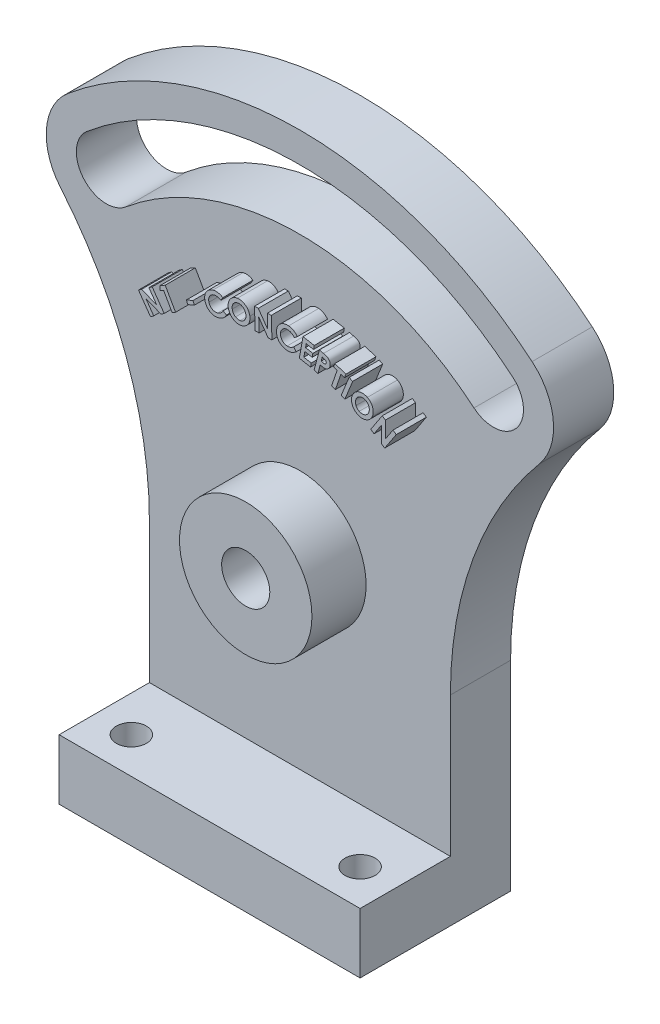
from build123d import *

# Parameters (mm, degrees)
SKETCH1_W             = 50
SKETCH1_H             = 10
BOSS_EXTRUDE2_DEPTH   = 25
SKETCH1_6_R           = 11
BOSS_EXTRUDE4_DEPTH   = 10
SKETCH1_7_R           = 11
SKETCH1_7_R_2         = 4
BOSS_EXTRUDE5_DEPTH   = 19
F_5_0MM_DOWEL_HOLE1_D = 5
BOSS_EXTRUDE8_DEPTH   = 15


with BuildPart() as part:
    # Sketch1 → Boss-Extrude2 (new body)
    with BuildSketch(Plane.XY):
        with Locations((0, 5)):
            Rectangle(SKETCH1_W, SKETCH1_H)
    extrude(amount=BOSS_EXTRUDE2_DEPTH)

    # Sketch1<6> → Boss-Extrude4 (add)
    # profile 1 of 2: a face of its own
    with BuildSketch(Plane.XY):
        with BuildLine():
            Line((-25, 33.212161292), (-25, 10))
            Line((-25, 10), (25, 10))
            Line((25, 10), (25, 33.212161292))
            ThreePointArc((25, 33.212161292), (28.814992323, 54.848057897), (39.799824916, 73.874346059))
            ThreePointArc((39.799824916, 73.874346059), (33.010937912, 70.340275175), (25.711504387, 72.641777725))
            ThreePointArc((25.711504387, 72.641777725), (0, 82), (-25.711504387, 72.641777725))
            ThreePointArc((-25.711504387, 72.641777725), (-33.010937912, 70.340275175), (-39.799824916, 73.874346059))
            ThreePointArc((-39.799824916, 73.874346059), (-28.814992323, 54.848057897), (-25, 33.212161292))
        make_face()
        with Locations((0, 42)):
            Circle(SKETCH1_6_R, mode=Mode.SUBTRACT)
    # profile 2 of 2: a face of its own
    with BuildSketch(Plane.XY):
        with BuildLine():
            ThreePointArc((38.567256581, 87.962666587), (0, 102), (-38.567256581, 87.962666587))
            ThreePointArc((-38.567256581, 87.962666587), (-39.799824916, 73.874346059), (-25.711504387, 72.641777725))
            ThreePointArc((-25.711504387, 72.641777725), (0, 82), (25.711504387, 72.641777725))
            ThreePointArc((25.711504387, 72.641777725), (39.799824916, 73.874346059), (38.567256581, 87.962666587))
        make_face()
        with BuildLine():
            ThreePointArc((-35.353318533, 84.132444372), (-35.9696027, 77.088284108), (-28.925442436, 76.47199994))
            ThreePointArc((-28.925442436, 76.47199994), (0, 87), (28.925442436, 76.47199994))
            ThreePointArc((28.925442436, 76.47199994), (35.9696027, 77.088284108), (35.353318533, 84.132444372))
            ThreePointArc((35.353318533, 84.132444372), (0, 97), (-35.353318533, 84.132444372))
        make_face(mode=Mode.SUBTRACT)
    extrude(amount=BOSS_EXTRUDE4_DEPTH)

    # Sketch1<7> → Boss-Extrude5 (add)
    with BuildSketch(Plane.XY):
        with Locations((0, 42)):
            Circle(SKETCH1_7_R)
        with Locations((0, 42)):
            Circle(SKETCH1_7_R_2, mode=Mode.SUBTRACT)
    extrude(amount=BOSS_EXTRUDE5_DEPTH)

    # Ø5.0mm Dowel Hole1 (through all)
    with Locations(Plane(origin=(0, 10, 0), x_dir=(1, 0, 0), z_dir=(0, 1, 0))):
        with Locations((-19, -19), (19, -19)):
            Hole(F_5_0MM_DOWEL_HOLE1_D / 2)

    # Sketch4 → Boss-Extrude8 (add)
    # profile 1 of 13: a face of its own
    with BuildSketch(Plane.XY):
        Polygon((18.682431406, 72.721270012), (19.21107724, 72.371410236), (19.192848073, 69.639138601), (20.455568426, 71.547592127), (21.007351278, 71.183008794), (19.088380926, 68.282467928), (18.558332849, 68.633028826), (18.575159772, 71.357588121), (17.315945028, 69.454743569), (16.763461054, 69.820729146), align=None)
    # profile 2 of 13: a face of its own
    with BuildSketch(Plane.XY):
        with BuildLine():
            add(Edge.make_bspline(
                [(16.203868259, 74.133777626), (16.257123915, 74.10520415), (16.362017883, 74.048924959), (16.506045323, 73.946307817), (16.638461873, 73.834192294), (16.756587557, 73.708561591), (16.86161766, 73.571139017), (16.953068695, 73.421637408), (17.031058138, 73.260235093), (17.094714455, 73.08902746), (17.143824492, 72.912732435), (17.174730567, 72.734943256), (17.188782427, 72.558104991), (17.182630299, 72.381883253), (17.159467601, 72.206685186), (17.118524845, 72.032325168), (17.058927801, 71.859208483), (17.006094701, 71.747635457), (16.979308964, 71.691069293)],
                knots=[0, 0, 0, 0, 1.016966423, 2.003048113, 2.971756742, 3.935165029, 4.901126884, 5.879978254, 6.881656156, 7.915439575, 8.952484951, 9.959392536, 10.95018434, 11.934717211, 12.923380096, 13.922045124, 14.946502205, 16, 16, 16, 16], degree=3))
            add(Edge.make_bspline(
                [(16.979308964, 71.691069293), (16.950026767, 71.636187336), (16.892492176, 71.52835352), (16.788333609, 71.379881192), (16.675363072, 71.243422351), (16.548575858, 71.122849072), (16.4123813, 71.014155923), (16.263035196, 70.922218359), (16.104171853, 70.841054704), (15.934745128, 70.777355147), (15.761149005, 70.727272412), (15.586355672, 70.695697074), (15.413039055, 70.681124806), (15.24078956, 70.685591453), (15.069554745, 70.707497361), (14.899421742, 70.746858852), (14.730509213, 70.804574795), (14.621918515, 70.855899273), (14.566748868, 70.881974742)],
                knots=[0, 0, 0, 0, 1.052750201, 2.068477073, 3.065958572, 4.048657294, 5.02672062, 6.011967468, 7.01398672, 8.043969217, 9.072756693, 10.070520933, 11.047550293, 12.013741356, 12.983477848, 13.96677438, 14.967017035, 16, 16, 16, 16], degree=3))
            add(Edge.make_bspline(
                [(14.566748868, 70.881974742), (14.510505645, 70.912246283), (14.400227464, 70.971600821), (14.247800789, 71.0771579), (14.110367295, 71.193638663), (13.988349816, 71.322145171), (13.880873716, 71.461778188), (13.789130988, 71.613235221), (13.711178471, 71.775503077), (13.65059634, 71.947610739), (13.605461414, 72.124125369), (13.576075283, 72.300981477), (13.56468425, 72.476445205), (13.57120644, 72.650208824), (13.594182141, 72.822467102), (13.635679879, 72.99268619), (13.692463303, 73.16200586), (13.744122457, 73.270473356), (13.770274509, 73.325384197)],
                knots=[0, 0, 0, 0, 1.070261725, 2.098502044, 3.10198407, 4.085935039, 5.064055821, 6.050601625, 7.049628701, 8.077092211, 9.104466052, 10.101046358, 11.078766755, 12.047280176, 13.012100529, 13.987234099, 14.981052657, 16, 16, 16, 16], degree=3))
            add(Edge.make_bspline(
                [(13.770274509, 73.325384197), (13.789420149, 73.361653305), (13.827400301, 73.433602126), (13.89262611, 73.53605432), (13.96224532, 73.633707064), (14.038486816, 73.724801506), (14.119164427, 73.811100069), (14.206368859, 73.890634792), (14.298458811, 73.965637988), (14.396456555, 74.033815039), (14.498208177, 74.096059811), (14.603224862, 74.150909737), (14.710367555, 74.198754675), (14.820334734, 74.238708269), (14.932630589, 74.271987621), (15.047993309, 74.296932078), (15.16572167, 74.315450647), (15.285433041, 74.325469157), (15.405319741, 74.329618058), (15.524478989, 74.324025478), (15.642189852, 74.312857758), (15.757952423, 74.291853194), (15.872276752, 74.264989053), (15.984326514, 74.228471319), (16.09584691, 74.186383246), (16.167660109, 74.151410735), (16.203868259, 74.133777626)],
                knots=[0, 0, 0, 0, 1.03530257, 2.053780863, 3.064379758, 4.061847691, 5.051339328, 6.045449244, 7.039997044, 8.04857762, 9.057727875, 10.05031245, 11.038465507, 12.018690845, 13.002888025, 13.993839466, 14.997156884, 16.010251535, 17.025801512, 18.024072291, 19.020649354, 20.00938386, 20.992802123, 21.983911727, 22.983490114, 24, 24, 24, 24], degree=3))
        make_face()
        with BuildLine():
            add(Edge.make_bspline(
                [(15.906592618, 73.56096112), (15.871127545, 73.577772654), (15.801248474, 73.61089748), (15.692705775, 73.648131345), (15.583652333, 73.67335362), (15.474218195, 73.687850071), (15.364435298, 73.68969447), (15.254289413, 73.680467232), (15.143608043, 73.660040476), (15.033764724, 73.627874889), (14.926989982, 73.585292645), (14.825340203, 73.533305697), (14.730247488, 73.4714612), (14.642155354, 73.399254736), (14.560425117, 73.317707655), (14.486039513, 73.225735458), (14.417642709, 73.124655697), (14.378459523, 73.051846403), (14.358515695, 73.014787242)],
                knots=[0, 0, 0, 0, 1.025995172, 2.021583028, 2.994313051, 3.949677728, 4.903476553, 5.86040452, 6.836375292, 7.842324895, 8.849202754, 9.838899115, 10.823997273, 11.810232783, 12.813057157, 13.838432976, 14.899785209, 16, 16, 16, 16], degree=3))
            add(Edge.make_bspline(
                [(14.358515695, 73.014787242), (14.338375837, 72.972653578), (14.298997486, 72.890271956), (14.257495293, 72.762198239), (14.2283839, 72.635567946), (14.216014685, 72.509353029), (14.217609322, 72.384064406), (14.236106019, 72.260049504), (14.266730094, 72.136251916), (14.299730608, 72.057158817), (14.316448387, 72.017090928)],
                knots=[0, 0, 0, 0, 1.082238879, 2.116041851, 3.11571799, 4.091061667, 5.050805887, 6.014568956, 6.994197566, 8, 8, 8, 8], degree=3))
            add(Edge.make_bspline(
                [(14.316448387, 72.017090928), (14.331182166, 71.986472425), (14.360328175, 71.925903635), (14.411768628, 71.839767684), (14.470102968, 71.760083003), (14.533994456, 71.685582434), (14.605372256, 71.618539054), (14.682172067, 71.556238769), (14.765428784, 71.500039274), (14.824938129, 71.468081997), (14.854909925, 71.451986761)],
                knots=[0, 0, 0, 0, 1.023731186, 2.025120523, 3.018351767, 3.99701602, 4.97848966, 5.965206198, 6.975179029, 8, 8, 8, 8], degree=3))
            add(Edge.make_bspline(
                [(14.854909925, 71.451986761), (14.889672054, 71.435618679), (14.958158791, 71.403371042), (15.064939362, 71.367757238), (15.172193753, 71.342725114), (15.280603075, 71.3305404), (15.389884777, 71.327631448), (15.499959729, 71.33909716), (15.611162855, 71.359850909), (15.721426238, 71.3932001), (15.82951246, 71.434776484), (15.930873866, 71.488294355), (16.0261172, 71.549157205), (16.114183066, 71.619487034), (16.194501858, 71.699615189), (16.268300513, 71.788237103), (16.335495018, 71.886006291), (16.373265542, 71.956638574), (16.392470021, 71.992551665)],
                knots=[0, 0, 0, 0, 1.014988562, 1.999683504, 2.969378646, 3.921175075, 4.87898819, 5.853395574, 6.840935595, 7.865301515, 8.894426074, 9.897536378, 10.889800068, 11.878807803, 12.870513538, 13.883846019, 14.924038338, 16, 16, 16, 16], degree=3))
            add(Edge.make_bspline(
                [(16.392470021, 71.992551665), (16.409746905, 72.029188426), (16.443710174, 72.10120976), (16.482265527, 72.212818298), (16.509865713, 72.32474378), (16.526299339, 72.43722178), (16.530336364, 72.550256798), (16.52320127, 72.66365902), (16.505072559, 72.777643846), (16.474718782, 72.890367598), (16.435087878, 72.999680773), (16.38711758, 73.103202711), (16.328981258, 73.198701924), (16.261957506, 73.286513723), (16.187029222, 73.367867022), (16.101753002, 73.440158859), (16.008607504, 73.505988356), (15.940892052, 73.542478183), (15.906592618, 73.56096112)],
                knots=[0, 0, 0, 0, 1.062922514, 2.089515947, 3.094104886, 4.086000992, 5.068495026, 6.058339088, 7.065137028, 8.093635972, 9.118559177, 10.115019144, 11.084259218, 12.047673882, 13.011557437, 13.981962277, 14.977817458, 16, 16, 16, 16], degree=3))
        make_face(mode=Mode.SUBTRACT)
    # profile 3 of 13: a face of its own
    with BuildSketch(Plane.XY):
        Polygon((13.164157853, 75.47508089), (13.772731571, 75.22898714), (12.470748397, 72.005930249), (11.86217468, 72.252023999), align=None)
    # profile 4 of 13: a face of its own
    with BuildSketch(Plane.XY):
        Polygon((10.810399963, 76.311499054), (12.627707655, 75.685397291), (12.415267751, 75.068410112), (11.816509738, 75.274539919), (10.896637944, 72.603967003), (10.261421597, 72.822717003), (11.181293392, 75.493289919), (10.597960059, 75.694511875), align=None)
    # profile 5 of 13: a face of its own
    with BuildSketch(Plane.XY):
        with BuildLine():
            Line((8.249292987, 76.992188171), (8.925875519, 76.813402113))
            add(Edge.make_bspline(
                [(8.925875519, 76.813402113), (8.969875744, 76.801474403), (9.054906253, 76.77842408), (9.176578875, 76.741524953), (9.287854529, 76.703537372), (9.388761705, 76.665235957), (9.479488662, 76.626268952), (9.559465749, 76.585950454), (9.630223497, 76.54697077), (9.690022779, 76.50437245), (9.743124714, 76.460940317), (9.790752249, 76.414531251), (9.834302984, 76.365305777), (9.874096556, 76.313435069), (9.908024094, 76.257478514), (9.939367001, 76.199579908), (9.965069282, 76.1378129), (9.987575617, 76.073808814), (10.00536087, 76.007058793), (10.016702264, 75.93821208), (10.024895271, 75.868040189), (10.026931863, 75.796031271), (10.02290403, 75.722549034), (10.015621489, 75.647294501), (10.002001559, 75.570539492), (9.98952521, 75.519301146), (9.983167186, 75.493189774)],
                knots=[0, 0, 0, 0, 1.684939958, 3.256149409, 4.698480276, 6.030010015, 7.244793055, 8.345770371, 9.340053484, 10.226754086, 11.055156978, 11.873728594, 12.68147231, 13.483095964, 14.286114637, 15.097590993, 15.914246111, 16.755652589, 17.604211835, 18.463388588, 19.332409497, 20.213877287, 21.121906148, 22.051054782, 23.006805649, 24, 24, 24, 24], degree=3))
            add(Edge.make_bspline(
                [(9.983167186, 75.493189774), (9.9752471, 75.464750458), (9.959660717, 75.40878313), (9.928207268, 75.328964662), (9.893389184, 75.253875518), (9.854295129, 75.183710111), (9.808722673, 75.119684599), (9.759249365, 75.060166572), (9.705073327, 75.00560548), (9.645760404, 74.957629493), (9.583696538, 74.913619173), (9.517341719, 74.877056901), (9.449073612, 74.844111676), (9.377417549, 74.817609264), (9.302769721, 74.796791341), (9.225367928, 74.780165505), (9.144836267, 74.770752116), (9.090191805, 74.768144527), (9.062594269, 74.766827594)],
                knots=[0, 0, 0, 0, 1.11652351, 2.19726936, 3.241835931, 4.247797466, 5.23174577, 6.21127199, 7.174369609, 8.135800791, 9.095114281, 10.049522855, 10.999001176, 11.961692612, 12.9360143, 13.929928894, 14.954535199, 16, 16, 16, 16], degree=3))
            add(Edge.make_bspline(
                [(9.062594269, 74.766827594), (9.044585007, 74.766762207), (9.005211784, 74.766619253), (8.941879163, 74.773321684), (8.869264194, 74.781926484), (8.788089802, 74.796767921), (8.69774376, 74.813897696), (8.598490944, 74.836103835), (8.490205791, 74.861782611), (8.415185988, 74.881420761), (8.376196032, 74.891627274)],
                knots=[0, 0, 0, 0, 0.617623238, 1.350294997, 2.182950527, 3.127044486, 4.18092688, 5.338813344, 6.616904527, 8, 8, 8, 8], degree=3))
            Line((8.376196032, 74.891627274), (8.001095872, 73.471855639))
            Line((8.001095872, 73.471855639), (7.363075039, 73.64012487))
            Line((7.363075039, 73.64012487), (8.249292987, 76.992188171))
        make_face()
        with BuildLine():
            Line((8.540959654, 75.513522306), (8.743583853, 75.460237049))
            add(Edge.make_bspline(
                [(8.743583853, 75.460237049), (8.780421951, 75.450778848), (8.848157805, 75.433387632), (8.942158613, 75.414339618), (9.019324129, 75.405626131), (9.082152953, 75.404153963), (9.134416442, 75.413570425), (9.181274676, 75.427831803), (9.224150262, 75.450371471), (9.263388556, 75.478928681), (9.298184192, 75.514335232), (9.326878983, 75.55625319), (9.350447097, 75.603682749), (9.360837239, 75.638134448), (9.366180007, 75.65585003)],
                knots=[0, 0, 0, 0, 1.827368794, 3.360064544, 4.602540165, 5.556972493, 6.365510791, 7.143208957, 7.901535489, 8.680853187, 9.466936481, 10.273679499, 11.112299991, 12, 12, 12, 12], degree=3))
            add(Edge.make_bspline(
                [(9.366180007, 75.65585003), (9.36973441, 75.671686042), (9.376584953, 75.702207412), (9.382003704, 75.747792955), (9.380538748, 75.791478507), (9.373290945, 75.833077616), (9.361778223, 75.873119311), (9.342616192, 75.910259508), (9.32009034, 75.946787508), (9.299992348, 75.967711043), (9.289757731, 75.978366056)],
                knots=[0, 0, 0, 0, 1.117488471, 2.153779645, 3.152254342, 4.115465916, 5.057463567, 6.00767647, 6.98543748, 8, 8, 8, 8], degree=3))
            add(Edge.make_bspline(
                [(9.289757731, 75.978366056), (9.281353915, 75.986612435), (9.263440797, 76.00418997), (9.22959816, 76.025684403), (9.190801446, 76.048594823), (9.14559658, 76.070716513), (9.093633082, 76.091650217), (9.035687158, 76.112633132), (8.971110405, 76.132924662), (8.925689601, 76.145167736), (8.902037378, 76.151543139)],
                knots=[0, 0, 0, 0, 0.657239408, 1.400935941, 2.233210833, 3.180824227, 4.213115058, 5.367455089, 6.629140534, 8, 8, 8, 8], degree=3))
            Line((8.902037378, 76.151543139), (8.721849077, 76.199219421))
            Line((8.721849077, 76.199219421), (8.540959654, 75.513522306))
        make_face(mode=Mode.SUBTRACT)
    # profile 6 of 13: a face of its own
    with BuildSketch(Plane.XY):
        Polygon((5.517022631, 77.53137599), (7.382006605, 77.19553865), (7.267723753, 76.55892006), (6.048472951, 76.778371182), (5.936994586, 76.160682881), (7.156245387, 75.941231759), (7.0440659, 75.31653224), (5.824815099, 75.535983362), (5.662855964, 74.637145221), (6.882106765, 74.417694099), (6.767122791, 73.778972144), (4.902138817, 74.114809483), align=None)
    # profile 7 of 13: a face of its own
    with BuildSketch(Plane.XY):
        with BuildLine():
            Line((4.584579757, 77.063708898), (4.084679918, 76.659161622))
            add(Edge.make_bspline(
                [(4.084679918, 76.659161622), (4.048477412, 76.702120491), (3.977856068, 76.785921682), (3.861865729, 76.898108086), (3.741201254, 76.995354054), (3.615332086, 77.077479322), (3.483840301, 77.143020858), (3.347568477, 77.193707543), (3.206421431, 77.230636406), (3.109619385, 77.241333607), (3.061042097, 77.246701686)],
                knots=[0, 0, 0, 0, 1.109297382, 2.163940613, 3.182084647, 4.166905867, 5.127044551, 6.078126383, 7.035563687, 8, 8, 8, 8], degree=3))
            add(Edge.make_bspline(
                [(3.061042097, 77.246701686), (3.020154457, 77.249147699), (2.939756683, 77.253957317), (2.820438359, 77.247161575), (2.70507048, 77.229925548), (2.593835678, 77.200828966), (2.48652904, 77.161612999), (2.383547752, 77.11052213), (2.284352592, 77.048658093), (2.190506313, 76.97597133), (2.103423871, 76.895486293), (2.025797842, 76.808206898), (1.958653991, 76.714903794), (1.901677004, 76.615824859), (1.855118514, 76.510778968), (1.819523666, 76.39978232), (1.792949295, 76.283202576), (1.784421856, 76.202856837), (1.780092578, 76.162066269)],
                knots=[0, 0, 0, 0, 1.0495536, 2.063747716, 3.05789681, 4.036095954, 5.006832392, 5.982366263, 6.978391997, 7.999625843, 9.021562751, 10.014898739, 10.989493437, 11.963959158, 12.940541625, 13.929783904, 14.948976125, 16, 16, 16, 16], degree=3))
            add(Edge.make_bspline(
                [(1.780092578, 76.162066269), (1.77843073, 76.133332933), (1.775162986, 76.076833692), (1.774782273, 75.992753548), (1.780869116, 75.911108938), (1.790132036, 75.831113104), (1.806116307, 75.753553498), (1.825170131, 75.677372588), (1.850990782, 75.603909741), (1.879999629, 75.532173617), (1.9147038, 75.463540784), (1.952832966, 75.397631545), (1.99615034, 75.335585999), (2.043245016, 75.276600239), (2.094327404, 75.220149421), (2.150596076, 75.167965875), (2.210306268, 75.118484053), (2.274239529, 75.073122499), (2.341057441, 75.03120679), (2.410763499, 74.993721662), (2.483169553, 74.961785429), (2.557445924, 74.933414899), (2.634184008, 74.910527333), (2.712961306, 74.89132173), (2.79424808, 74.877204277), (2.849493298, 74.871881465), (2.877348187, 74.86919768)],
                knots=[0, 0, 0, 0, 1.090457402, 2.14419981, 3.182651312, 4.190914144, 5.192936218, 6.180891499, 7.163794082, 8.140574845, 9.110791173, 10.075171074, 11.023315567, 11.974762271, 12.933760909, 13.904785079, 14.879838411, 15.870092649, 16.872545018, 17.866908212, 18.865795286, 19.869029538, 20.877486772, 21.897655589, 22.939988462, 24, 24, 24, 24], degree=3))
            add(Edge.make_bspline(
                [(2.877348187, 74.86919768), (2.92455279, 74.866532898), (3.017399949, 74.861291516), (3.154628137, 74.871187993), (3.287135027, 74.893123078), (3.393864146, 74.924627949), (3.478364837, 74.957385975), (3.543470637, 74.987581981), (3.610271564, 75.023649644), (3.678833502, 75.065173683), (3.749596935, 75.111599871), (3.822878816, 75.162534804), (3.896854623, 75.220431697), (3.946414591, 75.261250792), (3.971799309, 75.282158417)],
                knots=[0, 0, 0, 0, 1.410507696, 2.774340256, 4.098293068, 5.414443151, 6.088331431, 6.803349089, 7.555800814, 8.354071803, 9.196047244, 10.082759084, 11.01798525, 12, 12, 12, 12], degree=3))
            Line((3.971799309, 75.282158417), (4.38265668, 74.776649603))
            add(Edge.make_bspline(
                [(4.38265668, 74.776649603), (4.348509698, 74.748808476), (4.281610762, 74.694263634), (4.180204616, 74.618884583), (4.08072282, 74.55051285), (3.983677647, 74.488388645), (3.887576239, 74.434812463), (3.794040255, 74.387189818), (3.702214619, 74.347293431), (3.611694594, 74.313778706), (3.520431489, 74.28702441), (3.427570909, 74.264653311), (3.332136366, 74.246790614), (3.23392099, 74.235597163), (3.133199542, 74.226463372), (3.029492671, 74.22413797), (2.923296724, 74.226177323), (2.851860839, 74.230890877), (2.815649469, 74.233280212)],
                knots=[0, 0, 0, 0, 1.237227316, 2.423909383, 3.547202889, 4.626988604, 5.658477257, 6.635927709, 7.573608597, 8.468578224, 9.344942922, 10.242795989, 11.150384235, 12.069504536, 13.017920399, 13.989668805, 14.980948487, 16, 16, 16, 16], degree=3))
            add(Edge.make_bspline(
                [(2.815649469, 74.233280212), (2.749587147, 74.240347415), (2.620102131, 74.254199439), (2.43210487, 74.293476187), (2.255110805, 74.349415293), (2.088043, 74.419324692), (1.931522832, 74.505333427), (1.785579833, 74.606844994), (1.650297208, 74.723952881), (1.527008161, 74.855254797), (1.416888843, 74.997768856), (1.323469369, 75.149760164), (1.246360992, 75.309173056), (1.186516058, 75.476509549), (1.143547308, 75.65154248), (1.119050916, 75.834573701), (1.108900427, 76.024921488), (1.11694395, 76.153905565), (1.121038091, 76.219558257)],
                knots=[0, 0, 0, 0, 1.0879578, 2.132444454, 3.13990553, 4.124757049, 5.09460293, 6.060032978, 7.031781377, 8.02037652, 9.005942207, 9.97712477, 10.937775431, 11.901754384, 12.883273719, 13.884422205, 14.923174228, 16, 16, 16, 16], degree=3))
            add(Edge.make_bspline(
                [(1.121038091, 76.219558257), (1.125111346, 76.262172856), (1.133182187, 76.346610392), (1.155622523, 76.470301411), (1.183191722, 76.590425786), (1.219298669, 76.705666301), (1.26099783, 76.817306893), (1.311561895, 76.923821068), (1.366954442, 77.027381183), (1.43148869, 77.125372826), (1.500989657, 77.21921567), (1.577370089, 77.307359115), (1.659615477, 77.390238649), (1.747698641, 77.4680634), (1.842114568, 77.539671633), (1.942186171, 77.60582943), (2.048018504, 77.666696865), (2.159065892, 77.722145199), (2.274364281, 77.769753049), (2.391191682, 77.812004616), (2.510357694, 77.843529232), (2.630243987, 77.869534321), (2.752187536, 77.885719914), (2.875262906, 77.896264652), (3.000156558, 77.896522287), (3.083498485, 77.891475436), (3.125545302, 77.88892925)],
                knots=[0, 0, 0, 0, 1.058218405, 2.096777988, 3.106140833, 4.104288743, 5.081091568, 6.050703656, 7.017970267, 7.983024162, 8.949375185, 9.904128566, 10.864533077, 11.835040468, 12.80834895, 13.792578485, 14.799787933, 15.825922404, 16.859581572, 17.883239028, 18.895526444, 19.905501341, 20.914946917, 21.935368718, 22.958373332, 24, 24, 24, 24], degree=3))
            add(Edge.make_bspline(
                [(3.125545302, 77.88892925), (3.161103856, 77.885262514), (3.232208802, 77.877930296), (3.337938069, 77.861467001), (3.441854243, 77.837705337), (3.544625819, 77.810110926), (3.645614657, 77.775457933), (3.745122486, 77.735282402), (3.843758516, 77.690623863), (3.93999177, 77.639427063), (4.033728134, 77.583367508), (4.12448954, 77.523345231), (4.210621389, 77.457657354), (4.293765486, 77.388522089), (4.372098762, 77.313737519), (4.44749318, 77.235352799), (4.518324522, 77.151717371), (4.562423126, 77.093140101), (4.584579757, 77.063708898)],
                knots=[0, 0, 0, 0, 0.992295353, 1.9842513, 2.968026379, 3.950152822, 4.937003674, 5.929723121, 6.928424197, 7.94129136, 8.953805227, 9.959666596, 10.960094181, 11.959406193, 12.959875852, 13.964816179, 14.977454752, 16, 16, 16, 16], degree=3))
        make_face()
    # profile 8 of 13: a face of its own
    with BuildSketch(Plane.XY):
        Polygon((-2.544384435, 77.869896294), (-1.909869211, 77.890228826), (-0.344264243, 75.646639083), (-0.416479788, 77.937203986), (0.246080308, 77.95823764), (0.35615643, 74.477167929), (-0.280462159, 74.456835397), (-1.843963762, 76.693413922), (-1.771748217, 74.409860236), (-2.434308313, 74.388826583), align=None)
    # profile 9 of 13: a face of its own
    with BuildSketch(Plane.XY):
        with BuildLine():
            add(Edge.make_bspline(
                [(-5.380155719, 77.607337169), (-5.319957708, 77.614856379), (-5.20127915, 77.629680274), (-5.023307047, 77.630757868), (-4.849352702, 77.613619962), (-4.679109268, 77.580280505), (-4.51308568, 77.528438484), (-4.351100705, 77.45923782), (-4.192878219, 77.372554433), (-4.040790832, 77.26943218), (-3.897945086, 77.153279562), (-3.768105291, 77.026401445), (-3.654742018, 76.888505398), (-3.555748055, 76.741703345), (-3.473639163, 76.584046509), (-3.406143342, 76.417194712), (-3.35346458, 76.240423477), (-3.33190867, 76.117953712), (-3.320961007, 76.055754637)],
                knots=[0, 0, 0, 0, 1.014966012, 2.00097477, 2.97194078, 3.937238033, 4.900042225, 5.878226011, 6.88151869, 7.915699288, 8.950242486, 9.960097648, 10.9495007, 11.933745709, 12.919055561, 13.919529126, 14.943385215, 16, 16, 16, 16], degree=3))
            add(Edge.make_bspline(
                [(-3.320961007, 76.055754637), (-3.313250728, 75.99368376), (-3.298102255, 75.871732398), (-3.295672534, 75.689463545), (-3.310033477, 75.512101285), (-3.342790833, 75.339320378), (-3.391604146, 75.171118051), (-3.459114304, 75.008047746), (-3.543518952, 74.849676725), (-3.64495126, 74.6985089), (-3.757633445, 74.556055288), (-3.882735016, 74.428377137), (-4.016838403, 74.315888858), (-4.16041778, 74.218104217), (-4.313354456, 74.135923479), (-4.476181148, 74.070032567), (-4.647860997, 74.017782983), (-4.767097102, 73.99673563), (-4.827671745, 73.986043098)],
                knots=[0, 0, 0, 0, 1.052576191, 2.068008481, 3.063144327, 4.044142488, 5.024192992, 6.007123115, 7.010627454, 8.040965261, 9.068563844, 10.064827323, 11.04535177, 12.011332386, 12.984977989, 13.962774127, 14.965043099, 16, 16, 16, 16], degree=3))
            add(Edge.make_bspline(
                [(-4.827671745, 73.986043098), (-4.891137625, 73.978078031), (-5.016094609, 73.962395735), (-5.202447632, 73.959630938), (-5.383278107, 73.97597671), (-5.558330241, 74.009577207), (-5.728115383, 74.060729968), (-5.891407184, 74.131972346), (-6.049904107, 74.219565551), (-6.199969011, 74.325327632), (-6.340030303, 74.443603766), (-6.46677924, 74.572045627), (-6.5780931, 74.709563233), (-6.674965078, 74.855267087), (-6.755825911, 75.010224496), (-6.821076265, 75.174045827), (-6.872307583, 75.346288992), (-6.89360759, 75.465390346), (-6.904394501, 75.52570656)],
                knots=[0, 0, 0, 0, 1.065316885, 2.097485835, 3.098502177, 4.086094758, 5.063063937, 6.046956, 7.049372921, 8.075765394, 9.101004583, 10.10068666, 11.078121476, 12.044860493, 13.01165442, 13.985077476, 14.979587621, 16, 16, 16, 16], degree=3))
            add(Edge.make_bspline(
                [(-6.904394501, 75.52570656), (-6.909840588, 75.566785227), (-6.920611099, 75.648024887), (-6.927252362, 75.770068727), (-6.92705043, 75.890474426), (-6.917285438, 76.009602632), (-6.901722758, 76.127544565), (-6.876938958, 76.243917481), (-6.844368882, 76.358819215), (-6.80479591, 76.472127828), (-6.756974205, 76.58209707), (-6.704007198, 76.688651475), (-6.643196059, 76.789741985), (-6.57651653, 76.886723541), (-6.503612622, 76.979380273), (-6.423972914, 77.067464481), (-6.337767659, 77.150564989), (-6.245949608, 77.229251424), (-6.14923035, 77.301649449), (-6.04859784, 77.366956953), (-5.945224608, 77.425522998), (-5.838379918, 77.476723024), (-5.728401268, 77.521086362), (-5.615098262, 77.557248845), (-5.499129042, 77.587489924), (-5.420008896, 77.600688823), (-5.380155719, 77.607337169)],
                knots=[0, 0, 0, 0, 1.039639389, 2.056053777, 3.06492598, 4.059113214, 5.05369832, 6.048767578, 7.042175906, 8.04947825, 9.058401603, 10.049938059, 11.03372414, 12.016408037, 13.002080709, 13.99043729, 14.994267023, 16.005183203, 17.02342373, 18.023957932, 19.014122907, 20.003158024, 20.995405514, 21.987774349, 22.986432811, 24, 24, 24, 24], degree=3))
        make_face()
        with BuildLine():
            add(Edge.make_bspline(
                [(-5.289711007, 76.963707361), (-5.32866405, 76.956706479), (-5.405270179, 76.94293835), (-5.515925107, 76.910348663), (-5.62028698, 76.868248537), (-5.718309765, 76.816102569), (-5.809949378, 76.754040728), (-5.895240398, 76.682108888), (-5.973767397, 76.600271046), (-6.045802206, 76.510447128), (-6.108490291, 76.413298271), (-6.161565938, 76.311358171), (-6.203103328, 76.204867517), (-6.233433527, 76.094189423), (-6.252079179, 75.979481618), (-6.260548151, 75.860764066), (-6.257997188, 75.737935886), (-6.247282788, 75.65534507), (-6.241834405, 75.613346784)],
                knots=[0, 0, 0, 0, 1.027645979, 2.02099699, 2.990665437, 3.946799267, 4.899978813, 5.860881996, 6.839934061, 7.842244763, 8.847695411, 9.838910081, 10.823257302, 11.8116412, 12.814834283, 13.837499472, 14.900346057, 16, 16, 16, 16], degree=3))
            add(Edge.make_bspline(
                [(-6.241834405, 75.613346784), (-6.233675915, 75.567093062), (-6.217703853, 75.476541099), (-6.178049338, 75.346985529), (-6.126593643, 75.226967015), (-6.064012671, 75.115893021), (-5.989307039, 75.014489427), (-5.90306217, 74.922599676), (-5.804925029, 74.840275033), (-5.732003787, 74.794535458), (-5.694959405, 74.771299508)],
                knots=[0, 0, 0, 0, 1.082819494, 2.119860337, 3.117420415, 4.09050554, 5.054616138, 6.015888002, 6.992060472, 8, 8, 8, 8], degree=3))
            add(Edge.make_bspline(
                [(-5.694959405, 74.771299508), (-5.665112856, 74.754344666), (-5.606027277, 74.720780092), (-5.512923653, 74.681290704), (-5.418746823, 74.64939167), (-5.322793309, 74.6261701), (-5.225219085, 74.611199625), (-5.125946882, 74.605953521), (-5.025051895, 74.608378434), (-4.957796155, 74.616928243), (-4.92372543, 74.621259444)],
                knots=[0, 0, 0, 0, 1.026726346, 2.0325539, 3.021403827, 4.000405793, 4.983821688, 5.971780402, 6.97253513, 8, 8, 8, 8], degree=3))
            add(Edge.make_bspline(
                [(-4.92372543, 74.621259444), (-4.885705547, 74.628006485), (-4.81068043, 74.641320506), (-4.702195711, 74.673734192), (-4.600153959, 74.71708547), (-4.503127727, 74.768884979), (-4.412829362, 74.831758092), (-4.327741781, 74.903546539), (-4.249964871, 74.986422914), (-4.178195847, 75.077545036), (-4.114951047, 75.175391163), (-4.061980076, 75.27779638), (-4.019506388, 75.383331164), (-3.988577001, 75.492618362), (-3.968808648, 75.605400408), (-3.960890137, 75.721399506), (-3.962359837, 75.840696767), (-3.972668034, 75.920503218), (-3.977912129, 75.961103194)],
                knots=[0, 0, 0, 0, 1.01358347, 2.000117096, 2.965690691, 3.921439952, 4.883417066, 5.850121561, 6.840048294, 7.862919178, 8.892984161, 9.895015912, 10.886653843, 11.875647679, 12.872666131, 13.88812501, 14.925624751, 16, 16, 16, 16], degree=3))
            add(Edge.make_bspline(
                [(-3.977912129, 75.961103194), (-3.98485284, 76.001236362), (-3.998516066, 76.080241025), (-4.032024301, 76.19429015), (-4.074719493, 76.302174042), (-4.12764509, 76.403490746), (-4.189792532, 76.498864296), (-4.261291302, 76.588232672), (-4.343315871, 76.670402314), (-4.433322241, 76.745506527), (-4.528994814, 76.81285944), (-4.629861251, 76.867887146), (-4.732448339, 76.913689864), (-4.838624564, 76.946701264), (-4.947664404, 76.96844272), (-5.059488161, 76.979079736), (-5.174158387, 76.977583712), (-5.250740711, 76.968387182), (-5.289711007, 76.963707361)],
                knots=[0, 0, 0, 0, 1.062457494, 2.091514399, 3.09636213, 4.08686628, 5.069978224, 6.063708537, 7.068834016, 8.09521108, 9.120771941, 10.117437947, 11.08994953, 12.048914943, 13.013240611, 13.987549213, 14.975928119, 16, 16, 16, 16], degree=3))
        make_face(mode=Mode.SUBTRACT)
    # profile 10 of 13: a face of its own
    with BuildSketch(Plane.XY):
        with BuildLine():
            Line((-7.800010844, 76.480076045), (-8.128836966, 75.929695436))
            add(Edge.make_bspline(
                [(-8.128836966, 75.929695436), (-8.177451626, 75.957470904), (-8.272246725, 76.011631073), (-8.419381406, 76.07617352), (-8.565285708, 76.126209918), (-8.711399842, 76.158315113), (-8.856576163, 76.175764381), (-9.001398358, 76.17616749), (-9.145795319, 76.161543357), (-9.239859325, 76.138354239), (-9.287090171, 76.12671066)],
                knots=[0, 0, 0, 0, 1.110462108, 2.165321456, 3.18319303, 4.166680907, 5.12857339, 6.079376821, 7.03562838, 8, 8, 8, 8], degree=3))
            add(Edge.make_bspline(
                [(-9.287090171, 76.12671066), (-9.326167983, 76.114875714), (-9.403047279, 76.091592364), (-9.512035808, 76.043612301), (-9.614286658, 75.988803387), (-9.708176745, 75.923418812), (-9.794901386, 75.849725861), (-9.873703869, 75.766210503), (-9.945375861, 75.674379434), (-10.008085012, 75.57442011), (-10.060868695, 75.469376303), (-10.10355285, 75.36130278), (-10.134488953, 75.251151869), (-10.153671288, 75.138825012), (-10.160413452, 75.024838349), (-10.156183731, 74.908845941), (-10.140189514, 74.790916677), (-10.120759989, 74.712862451), (-10.11090828, 74.67328518)],
                knots=[0, 0, 0, 0, 1.050872816, 2.06742283, 3.061477782, 4.035032655, 5.008606141, 5.988006459, 6.987496973, 8.004670686, 9.022343084, 10.011702133, 10.993264751, 11.964154363, 12.941257791, 13.929205551, 14.950006958, 16, 16, 16, 16], degree=3))
            add(Edge.make_bspline(
                [(-10.11090828, 74.67328518), (-10.102815549, 74.645836765), (-10.086900028, 74.591855497), (-10.057730379, 74.513473311), (-10.025198822, 74.438544871), (-9.987625004, 74.367646174), (-9.947103557, 74.299918886), (-9.902002987, 74.236224892), (-9.853602165, 74.175547771), (-9.801082057, 74.118867075), (-9.745164434, 74.06658051), (-9.68655433, 74.018311922), (-9.624750082, 73.975000968), (-9.56044256, 73.935700254), (-9.493176663, 73.901068229), (-9.423382837, 73.871027398), (-9.350467526, 73.845677629), (-9.250128124, 73.817723434), (-9.12032755, 73.795519836), (-8.961818059, 73.789497293), (-8.800604547, 73.802800972), (-8.69508128, 73.828613161), (-8.641356998, 73.841754731)],
                knots=[0, 0, 0, 0, 0.907222209, 1.784183322, 2.650304891, 3.495630348, 4.326868791, 5.151373224, 5.968517058, 6.786634942, 7.599330418, 8.394536241, 9.192327995, 9.99053272, 10.78272829, 11.589454467, 12.398084746, 13.228794411, 14.890693029, 16.559534086, 18.248380979, 20, 20, 20, 20], degree=3))
            add(Edge.make_bspline(
                [(-8.641356998, 73.841754731), (-8.596399127, 73.855575577), (-8.507909193, 73.88277895), (-8.382441264, 73.938569239), (-8.267101461, 74.006287741), (-8.177790931, 74.071852132), (-8.110594614, 74.131692976), (-8.06017167, 74.182378642), (-8.009596709, 74.238330763), (-7.960056151, 74.300693656), (-7.909080613, 74.36761921), (-7.860149586, 74.44173897), (-7.808832753, 74.519956616), (-7.777053108, 74.575418476), (-7.760748023, 74.603874122)],
                knots=[0, 0, 0, 0, 1.410105389, 2.775490315, 4.10783956, 5.416156393, 6.091564543, 6.805468524, 7.560076834, 8.352838562, 9.194182472, 10.082864077, 11.016380969, 12, 12, 12, 12], degree=3))
            Line((-7.760748023, 74.603874122), (-7.202655075, 74.272243513))
            add(Edge.make_bspline(
                [(-7.202655075, 74.272243513), (-7.225027499, 74.23443286), (-7.268726484, 74.160579122), (-7.337824471, 74.055318916), (-7.406893528, 73.957039355), (-7.477232716, 73.866391097), (-7.547994341, 73.782761595), (-7.619326482, 73.706443489), (-7.691099223, 73.637032335), (-7.764593619, 73.574979852), (-7.840533312, 73.518204596), (-7.919852248, 73.465895843), (-8.002698894, 73.416115132), (-8.090683531, 73.372076095), (-8.181799873, 73.329095599), (-8.278079238, 73.292193189), (-8.377512618, 73.256264786), (-8.446081899, 73.23675113), (-8.480800107, 73.226870917)],
                knots=[0, 0, 0, 0, 1.239084899, 2.420245138, 3.550588261, 4.626569024, 5.655498751, 6.639590442, 7.572052318, 8.470138949, 9.350855565, 10.244916948, 11.14936828, 12.075118261, 13.018975207, 13.989728692, 14.982153305, 16, 16, 16, 16], degree=3))
            add(Edge.make_bspline(
                [(-8.480800107, 73.226870917), (-8.544814892, 73.21048283), (-8.670405774, 73.178330972), (-8.859987357, 73.151296857), (-9.044930225, 73.141974267), (-9.225389374, 73.149931677), (-9.401061949, 73.177005721), (-9.572285, 73.221053202), (-9.738807677, 73.284127377), (-9.899071767, 73.364515491), (-10.050894477, 73.459913954), (-10.190305614, 73.570104949), (-10.317488217, 73.692457466), (-10.430605177, 73.828620651), (-10.530921792, 73.977435627), (-10.616737531, 74.139718005), (-10.691542021, 74.314164385), (-10.728613615, 74.437291087), (-10.74752687, 74.500108096)],
                knots=[0, 0, 0, 0, 1.086406592, 2.131425754, 3.143798831, 4.129105686, 5.097503126, 6.062636292, 7.032345511, 8.020984593, 9.007625688, 9.976747877, 10.939258581, 11.905555001, 12.883370064, 13.886141548, 14.921547786, 16, 16, 16, 16], degree=3))
            add(Edge.make_bspline(
                [(-10.74752687, 74.500108096), (-10.758369305, 74.541581394), (-10.779731552, 74.623293927), (-10.801743182, 74.746609696), (-10.816993612, 74.86828699), (-10.823050527, 74.988486058), (-10.821722126, 75.107211952), (-10.812780528, 75.224382691), (-10.795278279, 75.340164659), (-10.769155434, 75.453963719), (-10.735369216, 75.56535512), (-10.694947081, 75.674268033), (-10.646242131, 75.779865515), (-10.589904321, 75.882253058), (-10.526876391, 75.981914746), (-10.456343563, 76.07838155), (-10.3785207, 76.171741303), (-10.293204565, 76.260900408), (-10.202418096, 76.345466618), (-10.107093608, 76.424184931), (-10.007316933, 76.495872641), (-9.903454436, 76.560334371), (-9.795517527, 76.618234905), (-9.683535511, 76.669146095), (-9.567539836, 76.713940562), (-9.487791226, 76.737464994), (-9.447647062, 76.749306814)],
                knots=[0, 0, 0, 0, 1.064154612, 2.096644657, 3.108057055, 4.107661212, 5.082753971, 6.054906102, 7.023448143, 7.987860293, 8.951783356, 9.912275827, 10.870521283, 11.836730449, 12.812444792, 13.79683721, 14.802237196, 15.828493715, 16.859220604, 17.881728648, 18.896432688, 19.907811783, 20.915270044, 21.935948191, 22.960989602, 24, 24, 24, 24], degree=3))
            add(Edge.make_bspline(
                [(-9.447647062, 76.749306814), (-9.413146054, 76.758318691), (-9.344315688, 76.776297607), (-9.239694654, 76.796695909), (-9.134266322, 76.810254515), (-9.028564219, 76.819922377), (-8.922272417, 76.822326394), (-8.815519128, 76.819895478), (-8.708181845, 76.810219157), (-8.600501523, 76.796500859), (-8.49339967, 76.777192841), (-8.388274664, 76.750833854), (-8.284777067, 76.71999416), (-8.183135652, 76.683939928), (-8.084277152, 76.640629213), (-7.987114299, 76.592823521), (-7.891723955, 76.540034727), (-7.830625327, 76.500090676), (-7.800010844, 76.480076045)],
                knots=[0, 0, 0, 0, 0.993665414, 1.982387134, 2.968057569, 3.955233337, 4.939115892, 5.929509671, 6.92966504, 7.941166762, 8.954282009, 9.960590417, 10.960045627, 11.963398519, 12.964062787, 13.966125193, 14.980893209, 16, 16, 16, 16], degree=3))
        make_face()
    # profile 11 of 13: a face of its own
    with BuildSketch(Plane.XY):
        Polygon((-13.855198264, 73.120883932), (-12.753735924, 73.588532169), (-12.520262366, 73.037450438), (-13.621724706, 72.569802201), align=None)
    # profile 12 of 13: a face of its own
    with BuildSketch(Plane.XY):
        Polygon((-18.240042322, 72.991761715), (-17.376961393, 73.481845849), (-15.655707386, 70.452298574), (-16.228523893, 70.126978061), (-17.642686553, 72.615259311), (-18.26668495, 72.260491683), align=None)
    # profile 13 of 13: a face of its own
    with BuildSketch(Plane.XY):
        Polygon((-21.815060905, 70.566606926), (-21.298334143, 70.929788015), (-18.77008895, 69.918069265), (-20.081887829, 71.784455483), (-19.542024046, 72.164463496), (-17.548734784, 69.328425836), (-18.067564912, 68.963141381), (-20.589500008, 69.9706534), (-19.281907861, 68.109876156), (-19.821771643, 67.730569265), align=None)
    extrude(amount=BOSS_EXTRUDE8_DEPTH)


solid = part.part
